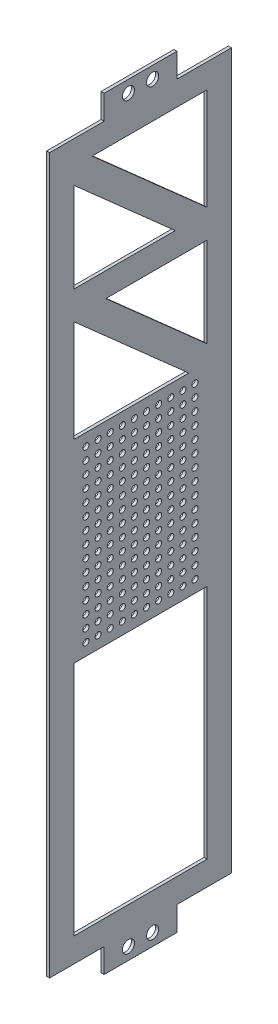
from build123d import *

# Parameters (mm, degrees)
SKETCH1_W                  = 95.25
SKETCH1_H                  = 374.65
MAINPLATEEXTRUDE_DEPTH     = 1.5875
SKETCH2_W                  = 38.1
SKETCH2_H                  = 12.7
SKETCH2_R                  = 3.175
RINGMOUNTINGBRACKETS_DEPTH = 1.5875
SKETCH4_W                  = 69.85
SKETCH4_H                  = 349.25
CUT_EXTRUDE1_DEPTH         = 1.5875
SKETCH5_W                  = 69.85
SKETCH5_H                  = 101.6
SKETCH5_R                  = 1.5875
BOSS_EXTRUDE3_DEPTH        = 1.5875
BOSS_EXTRUDE5_DEPTH        = 1.5875


with BuildPart() as part:
    # Sketch1 → MainPlateExtrude (new body)
    with BuildSketch(Plane(origin=(0, 0, 0), x_dir=(0, 0, -1), z_dir=(1, 0, 0))):
        with Locations((47.625, 187.325)):
            Rectangle(SKETCH1_W, SKETCH1_H)
    extrude(amount=MAINPLATEEXTRUDE_DEPTH)

    # Sketch2 → RingMountingBrackets (add)
    # profile 1 of 2: a face of its own
    with BuildSketch(Plane.ZY):
        with Locations((-47.625, 381)):
            Rectangle(SKETCH2_W, SKETCH2_H)
        with Locations((-53.975, 381)):
            Circle(SKETCH2_R, mode=Mode.SUBTRACT)
        with Locations((-41.275, 381)):
            Circle(SKETCH2_R, mode=Mode.SUBTRACT)
    # profile 2 of 2: a face of its own
    with BuildSketch(Plane.ZY):
        with Locations((-47.625, -6.35)):
            Rectangle(SKETCH2_W, SKETCH2_H)
        with Locations((-41.275, -6.35)):
            Circle(SKETCH2_R, mode=Mode.SUBTRACT)
        with Locations((-53.975, -6.35)):
            Circle(SKETCH2_R, mode=Mode.SUBTRACT)
    extrude(amount=-RINGMOUNTINGBRACKETS_DEPTH)

    # Sketch4 → Cut-Extrude1 (cut)
    with BuildSketch(Plane.ZY):
        with Locations((-47.625, 187.325)):
            Rectangle(SKETCH4_W, SKETCH4_H)
    extrude(amount=-CUT_EXTRUDE1_DEPTH, mode=Mode.SUBTRACT)

    # Sketch5 → Boss-Extrude3 (add)
    with BuildSketch(Plane.ZY):
        with Locations((-47.625, 187.325)):
            Rectangle(SKETCH5_W, SKETCH5_H)
        with Locations((-76.2, 231.775)):
            Circle(SKETCH5_R, mode=Mode.SUBTRACT)
        with Locations((-69.85, 231.775)):
            Circle(SKETCH5_R, mode=Mode.SUBTRACT)
        with Locations((-63.5, 231.775)):
            Circle(SKETCH5_R, mode=Mode.SUBTRACT)
        with Locations((-57.15, 231.775)):
            Circle(SKETCH5_R, mode=Mode.SUBTRACT)
        with Locations((-50.8, 231.775)):
            Circle(SKETCH5_R, mode=Mode.SUBTRACT)
        with Locations((-44.45, 231.775)):
            Circle(SKETCH5_R, mode=Mode.SUBTRACT)
        with Locations((-38.1, 231.775)):
            Circle(SKETCH5_R, mode=Mode.SUBTRACT)
        with Locations((-31.75, 231.775)):
            Circle(SKETCH5_R, mode=Mode.SUBTRACT)
        with Locations((-25.4, 231.775)):
            Circle(SKETCH5_R, mode=Mode.SUBTRACT)
        with Locations((-19.05, 231.775)):
            Circle(SKETCH5_R, mode=Mode.SUBTRACT)
        with Locations((-69.85, 225.425)):
            Circle(SKETCH5_R, mode=Mode.SUBTRACT)
        with Locations((-63.5, 225.425)):
            Circle(SKETCH5_R, mode=Mode.SUBTRACT)
        with Locations((-57.15, 225.425)):
            Circle(SKETCH5_R, mode=Mode.SUBTRACT)
        with Locations((-50.8, 225.425)):
            Circle(SKETCH5_R, mode=Mode.SUBTRACT)
        with Locations((-44.45, 225.425)):
            Circle(SKETCH5_R, mode=Mode.SUBTRACT)
        with Locations((-38.1, 225.425)):
            Circle(SKETCH5_R, mode=Mode.SUBTRACT)
        with Locations((-31.75, 225.425)):
            Circle(SKETCH5_R, mode=Mode.SUBTRACT)
        with Locations((-25.4, 225.425)):
            Circle(SKETCH5_R, mode=Mode.SUBTRACT)
        with Locations((-19.05, 225.425)):
            Circle(SKETCH5_R, mode=Mode.SUBTRACT)
        with Locations((-69.85, 219.075)):
            Circle(SKETCH5_R, mode=Mode.SUBTRACT)
        with Locations((-63.5, 219.075)):
            Circle(SKETCH5_R, mode=Mode.SUBTRACT)
        with Locations((-57.15, 219.075)):
            Circle(SKETCH5_R, mode=Mode.SUBTRACT)
        with Locations((-50.8, 219.075)):
            Circle(SKETCH5_R, mode=Mode.SUBTRACT)
        with Locations((-44.45, 219.075)):
            Circle(SKETCH5_R, mode=Mode.SUBTRACT)
        with Locations((-38.1, 219.075)):
            Circle(SKETCH5_R, mode=Mode.SUBTRACT)
        with Locations((-31.75, 219.075)):
            Circle(SKETCH5_R, mode=Mode.SUBTRACT)
        with Locations((-25.4, 219.075)):
            Circle(SKETCH5_R, mode=Mode.SUBTRACT)
        with Locations((-19.05, 219.075)):
            Circle(SKETCH5_R, mode=Mode.SUBTRACT)
        with Locations((-69.85, 212.725)):
            Circle(SKETCH5_R, mode=Mode.SUBTRACT)
        with Locations((-63.5, 212.725)):
            Circle(SKETCH5_R, mode=Mode.SUBTRACT)
        with Locations((-57.15, 212.725)):
            Circle(SKETCH5_R, mode=Mode.SUBTRACT)
        with Locations((-50.8, 212.725)):
            Circle(SKETCH5_R, mode=Mode.SUBTRACT)
        with Locations((-44.45, 212.725)):
            Circle(SKETCH5_R, mode=Mode.SUBTRACT)
        with Locations((-38.1, 212.725)):
            Circle(SKETCH5_R, mode=Mode.SUBTRACT)
        with Locations((-31.75, 212.725)):
            Circle(SKETCH5_R, mode=Mode.SUBTRACT)
        with Locations((-25.4, 212.725)):
            Circle(SKETCH5_R, mode=Mode.SUBTRACT)
        with Locations((-19.05, 212.725)):
            Circle(SKETCH5_R, mode=Mode.SUBTRACT)
        with Locations((-69.85, 206.375)):
            Circle(SKETCH5_R, mode=Mode.SUBTRACT)
        with Locations((-63.5, 206.375)):
            Circle(SKETCH5_R, mode=Mode.SUBTRACT)
        with Locations((-57.15, 206.375)):
            Circle(SKETCH5_R, mode=Mode.SUBTRACT)
        with Locations((-50.8, 206.375)):
            Circle(SKETCH5_R, mode=Mode.SUBTRACT)
        with Locations((-44.45, 206.375)):
            Circle(SKETCH5_R, mode=Mode.SUBTRACT)
        with Locations((-38.1, 206.375)):
            Circle(SKETCH5_R, mode=Mode.SUBTRACT)
        with Locations((-31.75, 206.375)):
            Circle(SKETCH5_R, mode=Mode.SUBTRACT)
        with Locations((-25.4, 206.375)):
            Circle(SKETCH5_R, mode=Mode.SUBTRACT)
        with Locations((-19.05, 206.375)):
            Circle(SKETCH5_R, mode=Mode.SUBTRACT)
        with Locations((-69.85, 200.025)):
            Circle(SKETCH5_R, mode=Mode.SUBTRACT)
        with Locations((-63.5, 200.025)):
            Circle(SKETCH5_R, mode=Mode.SUBTRACT)
        with Locations((-57.15, 200.025)):
            Circle(SKETCH5_R, mode=Mode.SUBTRACT)
        with Locations((-50.8, 200.025)):
            Circle(SKETCH5_R, mode=Mode.SUBTRACT)
        with Locations((-44.45, 200.025)):
            Circle(SKETCH5_R, mode=Mode.SUBTRACT)
        with Locations((-38.1, 200.025)):
            Circle(SKETCH5_R, mode=Mode.SUBTRACT)
        with Locations((-31.75, 200.025)):
            Circle(SKETCH5_R, mode=Mode.SUBTRACT)
        with Locations((-25.4, 200.025)):
            Circle(SKETCH5_R, mode=Mode.SUBTRACT)
        with Locations((-19.05, 200.025)):
            Circle(SKETCH5_R, mode=Mode.SUBTRACT)
        with Locations((-69.85, 193.675)):
            Circle(SKETCH5_R, mode=Mode.SUBTRACT)
        with Locations((-63.5, 193.675)):
            Circle(SKETCH5_R, mode=Mode.SUBTRACT)
        with Locations((-57.15, 193.675)):
            Circle(SKETCH5_R, mode=Mode.SUBTRACT)
        with Locations((-50.8, 193.675)):
            Circle(SKETCH5_R, mode=Mode.SUBTRACT)
        with Locations((-44.45, 193.675)):
            Circle(SKETCH5_R, mode=Mode.SUBTRACT)
        with Locations((-38.1, 193.675)):
            Circle(SKETCH5_R, mode=Mode.SUBTRACT)
        with Locations((-31.75, 193.675)):
            Circle(SKETCH5_R, mode=Mode.SUBTRACT)
        with Locations((-25.4, 193.675)):
            Circle(SKETCH5_R, mode=Mode.SUBTRACT)
        with Locations((-19.05, 193.675)):
            Circle(SKETCH5_R, mode=Mode.SUBTRACT)
        with Locations((-69.85, 187.325)):
            Circle(SKETCH5_R, mode=Mode.SUBTRACT)
        with Locations((-63.5, 187.325)):
            Circle(SKETCH5_R, mode=Mode.SUBTRACT)
        with Locations((-57.15, 187.325)):
            Circle(SKETCH5_R, mode=Mode.SUBTRACT)
        with Locations((-50.8, 187.325)):
            Circle(SKETCH5_R, mode=Mode.SUBTRACT)
        with Locations((-44.45, 187.325)):
            Circle(SKETCH5_R, mode=Mode.SUBTRACT)
        with Locations((-38.1, 187.325)):
            Circle(SKETCH5_R, mode=Mode.SUBTRACT)
        with Locations((-31.75, 187.325)):
            Circle(SKETCH5_R, mode=Mode.SUBTRACT)
        with Locations((-25.4, 187.325)):
            Circle(SKETCH5_R, mode=Mode.SUBTRACT)
        with Locations((-19.05, 187.325)):
            Circle(SKETCH5_R, mode=Mode.SUBTRACT)
        with Locations((-69.85, 180.975)):
            Circle(SKETCH5_R, mode=Mode.SUBTRACT)
        with Locations((-63.5, 180.975)):
            Circle(SKETCH5_R, mode=Mode.SUBTRACT)
        with Locations((-57.15, 180.975)):
            Circle(SKETCH5_R, mode=Mode.SUBTRACT)
        with Locations((-50.8, 180.975)):
            Circle(SKETCH5_R, mode=Mode.SUBTRACT)
        with Locations((-44.45, 180.975)):
            Circle(SKETCH5_R, mode=Mode.SUBTRACT)
        with Locations((-38.1, 180.975)):
            Circle(SKETCH5_R, mode=Mode.SUBTRACT)
        with Locations((-31.75, 180.975)):
            Circle(SKETCH5_R, mode=Mode.SUBTRACT)
        with Locations((-25.4, 180.975)):
            Circle(SKETCH5_R, mode=Mode.SUBTRACT)
        with Locations((-19.05, 180.975)):
            Circle(SKETCH5_R, mode=Mode.SUBTRACT)
        with Locations((-69.85, 174.625)):
            Circle(SKETCH5_R, mode=Mode.SUBTRACT)
        with Locations((-63.5, 174.625)):
            Circle(SKETCH5_R, mode=Mode.SUBTRACT)
        with Locations((-57.15, 174.625)):
            Circle(SKETCH5_R, mode=Mode.SUBTRACT)
        with Locations((-50.8, 174.625)):
            Circle(SKETCH5_R, mode=Mode.SUBTRACT)
        with Locations((-44.45, 174.625)):
            Circle(SKETCH5_R, mode=Mode.SUBTRACT)
        with Locations((-38.1, 174.625)):
            Circle(SKETCH5_R, mode=Mode.SUBTRACT)
        with Locations((-31.75, 174.625)):
            Circle(SKETCH5_R, mode=Mode.SUBTRACT)
        with Locations((-25.4, 174.625)):
            Circle(SKETCH5_R, mode=Mode.SUBTRACT)
        with Locations((-19.05, 174.625)):
            Circle(SKETCH5_R, mode=Mode.SUBTRACT)
        with Locations((-69.85, 168.275)):
            Circle(SKETCH5_R, mode=Mode.SUBTRACT)
        with Locations((-63.5, 168.275)):
            Circle(SKETCH5_R, mode=Mode.SUBTRACT)
        with Locations((-57.15, 168.275)):
            Circle(SKETCH5_R, mode=Mode.SUBTRACT)
        with Locations((-50.8, 168.275)):
            Circle(SKETCH5_R, mode=Mode.SUBTRACT)
        with Locations((-44.45, 168.275)):
            Circle(SKETCH5_R, mode=Mode.SUBTRACT)
        with Locations((-38.1, 168.275)):
            Circle(SKETCH5_R, mode=Mode.SUBTRACT)
        with Locations((-31.75, 168.275)):
            Circle(SKETCH5_R, mode=Mode.SUBTRACT)
        with Locations((-25.4, 168.275)):
            Circle(SKETCH5_R, mode=Mode.SUBTRACT)
        with Locations((-19.05, 168.275)):
            Circle(SKETCH5_R, mode=Mode.SUBTRACT)
        with Locations((-69.85, 161.925)):
            Circle(SKETCH5_R, mode=Mode.SUBTRACT)
        with Locations((-63.5, 161.925)):
            Circle(SKETCH5_R, mode=Mode.SUBTRACT)
        with Locations((-57.15, 161.925)):
            Circle(SKETCH5_R, mode=Mode.SUBTRACT)
        with Locations((-50.8, 161.925)):
            Circle(SKETCH5_R, mode=Mode.SUBTRACT)
        with Locations((-44.45, 161.925)):
            Circle(SKETCH5_R, mode=Mode.SUBTRACT)
        with Locations((-38.1, 161.925)):
            Circle(SKETCH5_R, mode=Mode.SUBTRACT)
        with Locations((-31.75, 161.925)):
            Circle(SKETCH5_R, mode=Mode.SUBTRACT)
        with Locations((-25.4, 161.925)):
            Circle(SKETCH5_R, mode=Mode.SUBTRACT)
        with Locations((-19.05, 161.925)):
            Circle(SKETCH5_R, mode=Mode.SUBTRACT)
        with Locations((-69.85, 155.575)):
            Circle(SKETCH5_R, mode=Mode.SUBTRACT)
        with Locations((-63.5, 155.575)):
            Circle(SKETCH5_R, mode=Mode.SUBTRACT)
        with Locations((-57.15, 155.575)):
            Circle(SKETCH5_R, mode=Mode.SUBTRACT)
        with Locations((-50.8, 155.575)):
            Circle(SKETCH5_R, mode=Mode.SUBTRACT)
        with Locations((-44.45, 155.575)):
            Circle(SKETCH5_R, mode=Mode.SUBTRACT)
        with Locations((-38.1, 155.575)):
            Circle(SKETCH5_R, mode=Mode.SUBTRACT)
        with Locations((-31.75, 155.575)):
            Circle(SKETCH5_R, mode=Mode.SUBTRACT)
        with Locations((-25.4, 155.575)):
            Circle(SKETCH5_R, mode=Mode.SUBTRACT)
        with Locations((-19.05, 155.575)):
            Circle(SKETCH5_R, mode=Mode.SUBTRACT)
        with Locations((-69.85, 149.225)):
            Circle(SKETCH5_R, mode=Mode.SUBTRACT)
        with Locations((-63.5, 149.225)):
            Circle(SKETCH5_R, mode=Mode.SUBTRACT)
        with Locations((-57.15, 149.225)):
            Circle(SKETCH5_R, mode=Mode.SUBTRACT)
        with Locations((-50.8, 149.225)):
            Circle(SKETCH5_R, mode=Mode.SUBTRACT)
        with Locations((-44.45, 149.225)):
            Circle(SKETCH5_R, mode=Mode.SUBTRACT)
        with Locations((-38.1, 149.225)):
            Circle(SKETCH5_R, mode=Mode.SUBTRACT)
        with Locations((-31.75, 149.225)):
            Circle(SKETCH5_R, mode=Mode.SUBTRACT)
        with Locations((-25.4, 149.225)):
            Circle(SKETCH5_R, mode=Mode.SUBTRACT)
        with Locations((-19.05, 149.225)):
            Circle(SKETCH5_R, mode=Mode.SUBTRACT)
        with Locations((-69.85, 142.875)):
            Circle(SKETCH5_R, mode=Mode.SUBTRACT)
        with Locations((-63.5, 142.875)):
            Circle(SKETCH5_R, mode=Mode.SUBTRACT)
        with Locations((-57.15, 142.875)):
            Circle(SKETCH5_R, mode=Mode.SUBTRACT)
        with Locations((-50.8, 142.875)):
            Circle(SKETCH5_R, mode=Mode.SUBTRACT)
        with Locations((-44.45, 142.875)):
            Circle(SKETCH5_R, mode=Mode.SUBTRACT)
        with Locations((-38.1, 142.875)):
            Circle(SKETCH5_R, mode=Mode.SUBTRACT)
        with Locations((-31.75, 142.875)):
            Circle(SKETCH5_R, mode=Mode.SUBTRACT)
        with Locations((-25.4, 142.875)):
            Circle(SKETCH5_R, mode=Mode.SUBTRACT)
        with Locations((-19.05, 142.875)):
            Circle(SKETCH5_R, mode=Mode.SUBTRACT)
        with Locations((-76.2, 225.425)):
            Circle(SKETCH5_R, mode=Mode.SUBTRACT)
        with Locations((-76.2, 219.075)):
            Circle(SKETCH5_R, mode=Mode.SUBTRACT)
        with Locations((-76.2, 212.725)):
            Circle(SKETCH5_R, mode=Mode.SUBTRACT)
        with Locations((-76.2, 206.375)):
            Circle(SKETCH5_R, mode=Mode.SUBTRACT)
        with Locations((-76.2, 200.025)):
            Circle(SKETCH5_R, mode=Mode.SUBTRACT)
        with Locations((-76.2, 193.675)):
            Circle(SKETCH5_R, mode=Mode.SUBTRACT)
        with Locations((-76.2, 187.325)):
            Circle(SKETCH5_R, mode=Mode.SUBTRACT)
        with Locations((-76.2, 180.975)):
            Circle(SKETCH5_R, mode=Mode.SUBTRACT)
        with Locations((-76.2, 174.625)):
            Circle(SKETCH5_R, mode=Mode.SUBTRACT)
        with Locations((-76.2, 168.275)):
            Circle(SKETCH5_R, mode=Mode.SUBTRACT)
        with Locations((-76.2, 161.925)):
            Circle(SKETCH5_R, mode=Mode.SUBTRACT)
        with Locations((-76.2, 155.575)):
            Circle(SKETCH5_R, mode=Mode.SUBTRACT)
        with Locations((-76.2, 149.225)):
            Circle(SKETCH5_R, mode=Mode.SUBTRACT)
        with Locations((-76.2, 142.875)):
            Circle(SKETCH5_R, mode=Mode.SUBTRACT)
    extrude(amount=-BOSS_EXTRUDE3_DEPTH)

    # Sketch6 → Boss-Extrude5 (add)
    with BuildSketch(Plane.ZY):
        Polygon((-82.55, 293.6875), (-29.437339506, 293.6875), (-82.55, 246.610369108), (-82.55, 238.125), (-72.976763058, 238.125), (-12.7, 291.552130892), (-12.7, 306.3875), (-65.812660494, 306.3875), (-12.7, 353.464630892), (-12.7, 361.95), (-22.273236942, 361.95), (-82.55, 308.522869108), align=None)
    extrude(amount=-BOSS_EXTRUDE5_DEPTH)


solid = part.part
